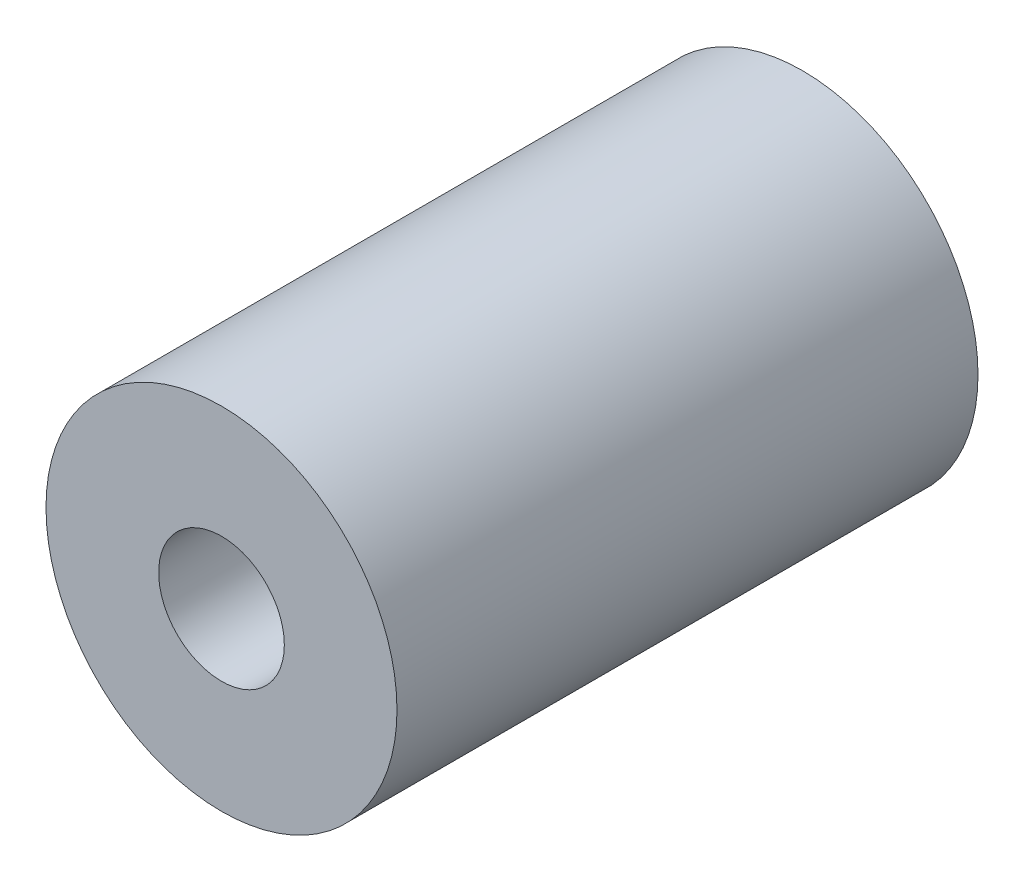
from build123d import *

# Parameters (mm, degrees)
SKETCH_1_R      = 4.9
SKETCH_1_R_2    = 2.65
EXTRUDE_1_DEPTH = 24.5
SKETCH_3_R      = 7.4
SKETCH_3_R_2    = 2.65
EXTRUDE_3_DEPTH = 24.5


with BuildPart() as part:
    # 草图1 → 凸台-拉伸1 (new body)
    with BuildSketch(Plane.XY):
        Circle(SKETCH_1_R)
        Circle(SKETCH_1_R_2, mode=Mode.SUBTRACT)
    extrude(amount=EXTRUDE_1_DEPTH)

    # 草图3 → 凸台-拉伸3 (add)
    with BuildSketch(Plane(origin=(0, 0, 0), x_dir=(-1, 0, 0), z_dir=(0, 0, -1))):
        Circle(SKETCH_3_R)
        with Locations(Location((0, 0, 0), (0, 0, 180))):
            Circle(SKETCH_3_R_2, mode=Mode.SUBTRACT)
    extrude(amount=-EXTRUDE_3_DEPTH)


solid = part.part
